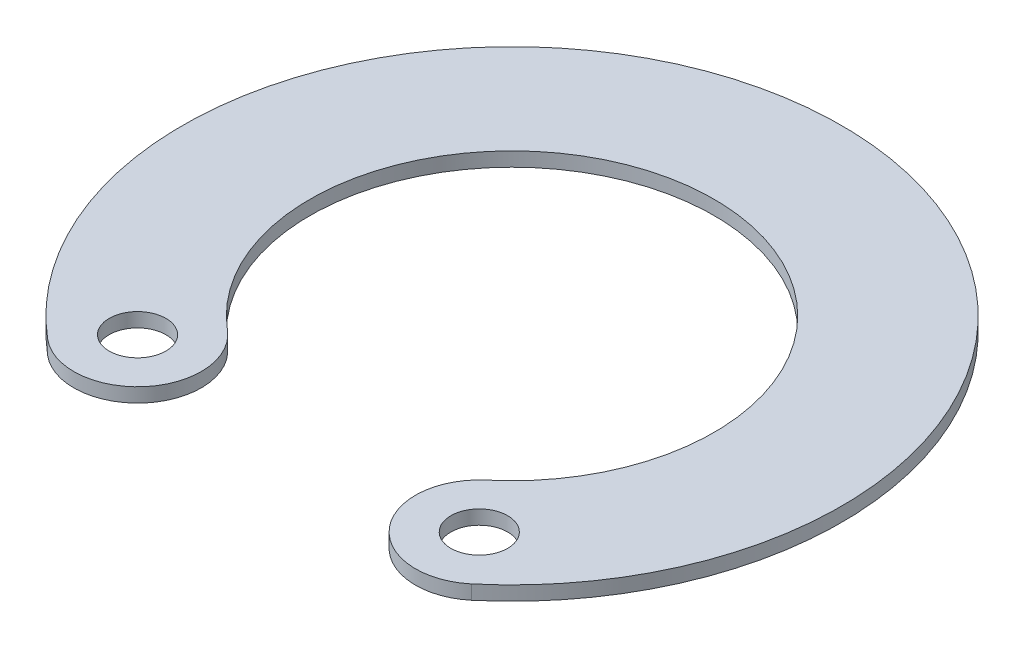
from build123d import *

# Parameters (mm, degrees)
SKETCH2_R           = 0.4
BOSS_EXTRUDE1_DEPTH = 0.2


with BuildPart() as part:
    # Sketch2 → Boss-Extrude1 (new body)
    with BuildSketch(Plane(origin=(0, 0, 0), x_dir=(1, 0, 0), z_dir=(0, 1, 0))):
        with BuildLine():
            ThreePointArc((2.988962385, -3.562106661), (0, 4.65), (-2.988962385, -3.562106661))
            ThreePointArc((-2.988962385, -3.562106661), (-1.721013538, -3.45117551), (-1.831944688, -2.183226663))
            ThreePointArc((-1.831944688, -2.183226663), (0, 2.85), (1.831944688, -2.183226663))
            ThreePointArc((1.831944688, -2.183226663), (1.721013538, -3.45117551), (2.988962385, -3.562106661))
        make_face()
        with Locations(Location((-2.410453536, -2.872666662, 0), (0, 0, 270))):
            Circle(SKETCH2_R, mode=Mode.SUBTRACT)
        with Locations(Location((2.410453536, -2.872666662, 0), (0, 0, 270))):
            Circle(SKETCH2_R, mode=Mode.SUBTRACT)
    extrude(amount=BOSS_EXTRUDE1_DEPTH)


solid = part.part
